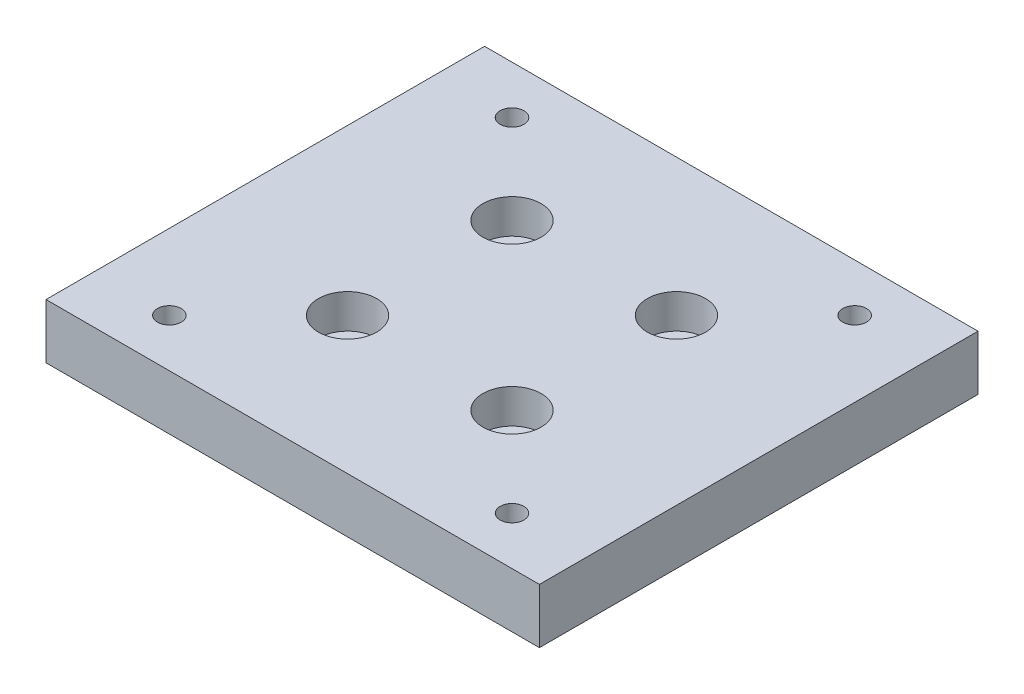
from build123d import *

# Parameters (mm, degrees)
SKETCH1_W                                         = 114.3
SKETCH1_H                                         = 101.6
BOSS_EXTRUDE1_DEPTH                               = 12.7
CBORE_FOR_5_16_SOCKET_HEAD_CAP_SCREW1_D           = 8.4328
CBORE_FOR_5_16_SOCKET_HEAD_CAP_SCREW1_CBORE_D     = 13.49502
CBORE_FOR_5_16_SOCKET_HEAD_CAP_SCREW1_CBORE_DEPTH = 7.9375
M5_CLEARANCE_HOLE1_D                              = 5.5


with BuildPart() as part:
    # Sketch1 → Boss-Extrude1 (new body)
    with BuildSketch(Plane(origin=(0, 0, 0), x_dir=(1, 0, 0), z_dir=(0, 1, 0))):
        with Locations((57.15, 50.8)):
            Rectangle(SKETCH1_W, SKETCH1_H)
    extrude(amount=BOSS_EXTRUDE1_DEPTH)

    # CBORE for 5/16 Socket Head Cap Screw1 (through all)
    with Locations(Plane(origin=(0, 12.7, 0), x_dir=(1, 0, 0), z_dir=(0, 1, 0))):
        with Locations((38.1, 69.85), (76.2, 69.85), (76.2, 31.75), (38.1, 31.75)):
            CounterBoreHole(CBORE_FOR_5_16_SOCKET_HEAD_CAP_SCREW1_D / 2, CBORE_FOR_5_16_SOCKET_HEAD_CAP_SCREW1_CBORE_D / 2, CBORE_FOR_5_16_SOCKET_HEAD_CAP_SCREW1_CBORE_DEPTH)

    # M5 Clearance Hole1 (through all)
    with Locations(Plane(origin=(0, 12.7, 0), x_dir=(1, 0, 0), z_dir=(0, 1, 0))):
        with Locations((17.4625, 11.1125), (96.8375, 11.1125), (96.8375, 90.4875), (17.4625, 90.4875)):
            Hole(M5_CLEARANCE_HOLE1_D / 2)


solid = part.part
